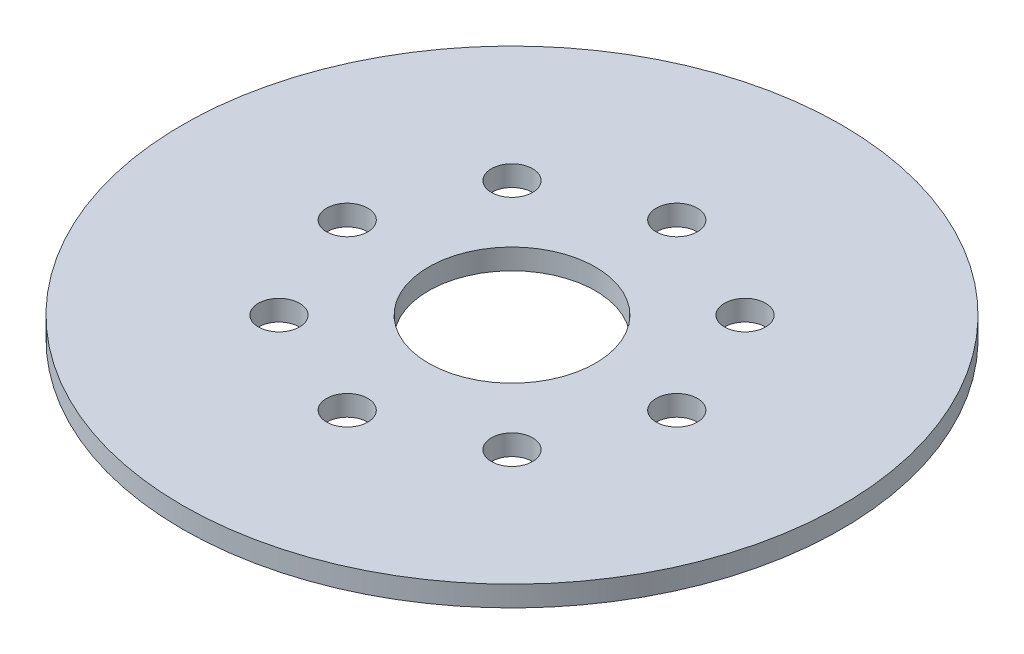
from build123d import *

# Parameters (mm, degrees)
SKETCH1_R           = 16
SKETCH1_R_2         = 4.05
SKETCH1_R_3         = 1
BOSS_EXTRUDE1_DEPTH = 1


with BuildPart() as part:
    # Sketch1 → Boss-Extrude1 (new body)
    with BuildSketch(Plane(origin=(0, 0, 0), x_dir=(1, 0, 0), z_dir=(0, 1, 0))):
        with Locations(Location((0, 0, 0), (0, 0, 270))):
            Circle(SKETCH1_R)
        with Locations(Location((0, 0, 0), (0, 0, 270))):
            Circle(SKETCH1_R_2, mode=Mode.SUBTRACT)
        with Locations(Location((0, 8, 0), (0, 0, 270))):
            Circle(SKETCH1_R_3, mode=Mode.SUBTRACT)
        with Locations(Location((5.656854249, 5.656854249, 0), (0, 0, 270))):
            Circle(SKETCH1_R_3, mode=Mode.SUBTRACT)
        with Locations(Location((8, 0, 0), (0, 0, 270))):
            Circle(SKETCH1_R_3, mode=Mode.SUBTRACT)
        with Locations(Location((5.656854249, -5.656854249, 0), (0, 0, 270))):
            Circle(SKETCH1_R_3, mode=Mode.SUBTRACT)
        with Locations(Location((0, -8, 0), (0, 0, 270))):
            Circle(SKETCH1_R_3, mode=Mode.SUBTRACT)
        with Locations(Location((-5.656854249, -5.656854249, 0), (0, 0, 270))):
            Circle(SKETCH1_R_3, mode=Mode.SUBTRACT)
        with Locations(Location((-8, 0, 0), (0, 0, 270))):
            Circle(SKETCH1_R_3, mode=Mode.SUBTRACT)
        with Locations(Location((-5.656854249, 5.656854249, 0), (0, 0, 270))):
            Circle(SKETCH1_R_3, mode=Mode.SUBTRACT)
    extrude(amount=BOSS_EXTRUDE1_DEPTH)


solid = part.part
